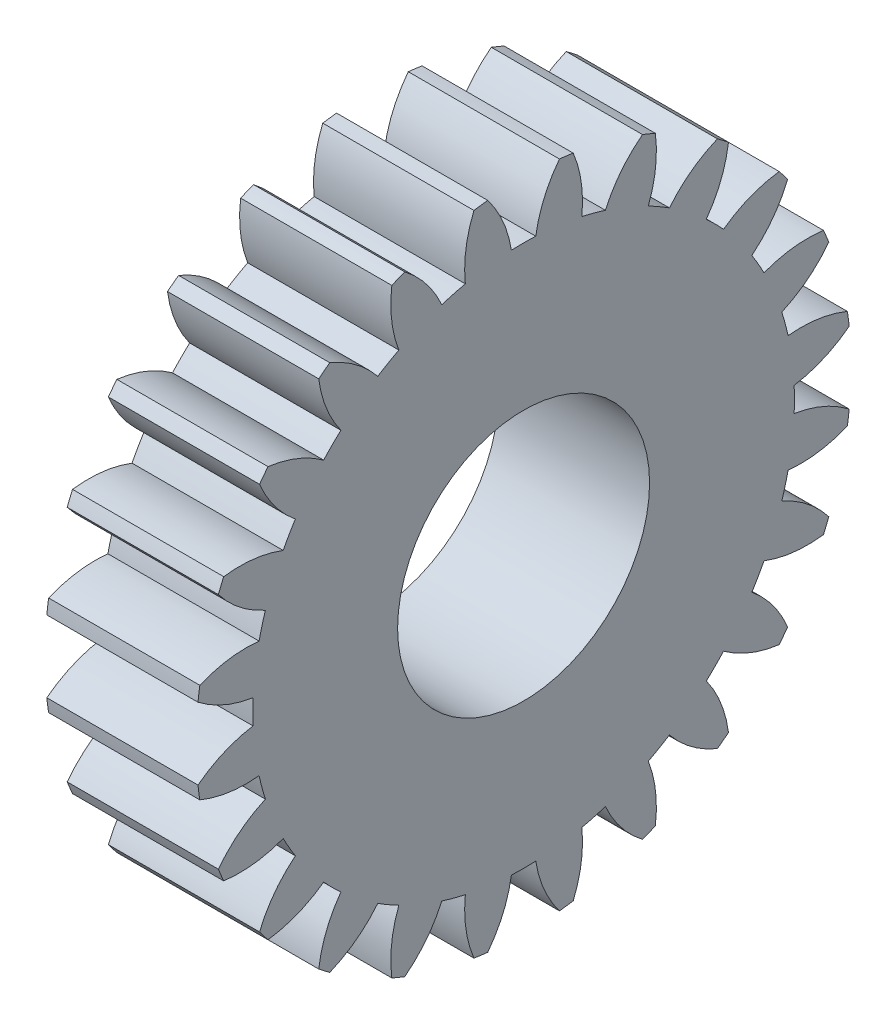
from build123d import *

# Parameters (mm, degrees)
BASPROSKE_W     = 6
BASPROSKE_H     = 13
TOOTHCUT_DEPTH  = 20.339079606
TEETHCUTS_COUNT = 24
TEETHCUTS_ANGLE = 345
BORSKE_R        = 5
BORE_DEPTH      = 50.0000508


with BuildPart() as part:
    # BasProSke → Base-Revolve (revolve)
    with BuildSketch(Plane(origin=(0, 0, 0), x_dir=(1, 0, 0), z_dir=(0, 1, 0)), mode=Mode.PRIVATE) as base_revolve_sk:
        with Locations((3, 6.5)):
            Rectangle(BASPROSKE_W, BASPROSKE_H)
    revolve(base_revolve_sk.sketch.rotate(Axis((-10, 0, 0), (1, 0, 0)), 180), axis=Axis((-10, 0, 0), (1, 0, 0)))

    # TooCutSke → ToothCut (cut, through all)
    with BuildSketch(Plane(origin=(0, 0, 0), x_dir=(0, 0, -1), z_dir=(1, 0, 0))):
        with BuildLine():
            ThreePointArc((0.483448384, 10.738122679), (0, 10.749), (-0.483448384, 10.738122679))
            ThreePointArc((-0.483448384, 10.738122679), (-0.821636462, 11.902754369), (-1.44092227, 12.945454344))
            ThreePointArc((-1.44092227, 12.945454344), (0, 13.0254), (1.44092227, 12.945454344))
            ThreePointArc((1.44092227, 12.945454344), (0.821636462, 11.902754369), (0.483448384, 10.738122679))
        make_face()
    toothcut = extrude(amount=TOOTHCUT_DEPTH, mode=Mode.SUBTRACT)

    # TeethCuts: ToothCut ×24 about axis
    teethcuts_axis = Axis((-10, 0, 0), (1, 0, 0))
    for i in range(1, TEETHCUTS_COUNT):
        add(toothcut.rotate(teethcuts_axis, i * TEETHCUTS_ANGLE / (TEETHCUTS_COUNT - 1)), mode=Mode.SUBTRACT)

    # BorSke → Bore (cut, symmetric)
    with BuildSketch(Plane(origin=(0, 0, 0), x_dir=(0, 0, -1), z_dir=(1, 0, 0))):
        with Locations(Location((0, 0, 0), (0, 0, 180))):
            Circle(BORSKE_R)
    extrude(amount=BORE_DEPTH, both=True, mode=Mode.SUBTRACT)


solid = part.part
